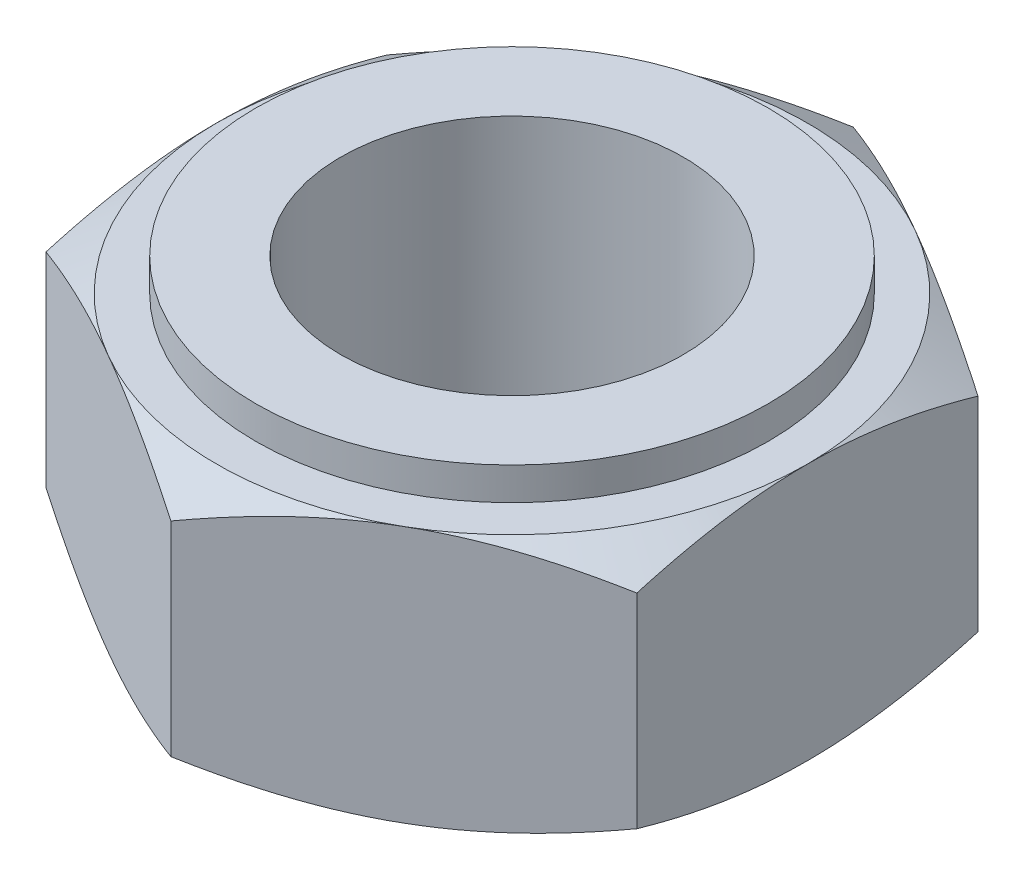
from build123d import *

# Parameters (mm, degrees)
SKETCH1_R               = 2
BOSS_EXTRUDE1_DEPTH     = 1.5
SKETCH6_R               = 2.991858429
SKETCH6_R_2             = 2
BOSS_EXTRUDE2_DEPTH     = 0.381
SKETCH5_OUTSIDE_W       = 35.584
SKETCH5_OUTSIDE_H       = 36.652
SKETCH5_OUTSIDE_R       = 3.45
CUT_EXTRUDE2_DEPTH      = 7.064033311
CUT_EXTRUDE2_DRAFT      = -60
MIRROR2_COPY_1_SKETCH_W = 35.584
MIRROR2_COPY_1_SKETCH_H = 36.652
MIRROR2_COPY_1_SKETCH_R = 3.45
MIRROR2_COPY_1_DEPTH    = 7.064033311
MIRROR2_COPY_1_DRAFT    = -60


with BuildPart() as part:
    # Sketch1 → Boss-Extrude1 (new, symmetric)
    with BuildSketch(Plane(origin=(0, 0, 0), x_dir=(1, 0, 0), z_dir=(0, 1, 0))):
        Polygon((-3.45, 1.991858429), (-3.45, -1.991858429), (0, -3.983716857), (3.45, -1.991858429), (3.45, 1.991858429), (0, 3.983716857), align=None)
        Circle(SKETCH1_R, mode=Mode.SUBTRACT)
    extrude(amount=BOSS_EXTRUDE1_DEPTH, both=True)

    # Sketch6 → Boss-Extrude2 (add)
    with BuildSketch(Plane(origin=(0, 1.5, 0), x_dir=(1, 0, 0), z_dir=(0, 1, 0))):
        Circle(SKETCH6_R)
        Circle(SKETCH6_R_2, mode=Mode.SUBTRACT)
    extrude(amount=BOSS_EXTRUDE2_DEPTH)


with BuildPart() as cut_extrude2_tool:
    # Sketch5 outside → Cut-Extrude2 (with draft: the straight prism first)
    with BuildSketch(Plane(origin=(0, 1.5, 0), x_dir=(1, 0, 0), z_dir=(0, 1, 0))):
        Rectangle(SKETCH5_OUTSIDE_W, SKETCH5_OUTSIDE_H)
        Circle(SKETCH5_OUTSIDE_R, mode=Mode.SUBTRACT)
    extrude(amount=-CUT_EXTRUDE2_DEPTH)
    # Cut-Extrude2: the draft: its side faces are tilted about the plane it starts from
    cut_extrude2_sides = [cut_extrude2_tool.faces().sort_by_distance(p)[0] for p in [
        (0, -2.032016656, 18.326),
        (17.792, -2.032016656, 0),
        (0, -2.032016656, -18.326),
        (-17.792, -2.032016656, 0),
        (-3.45, -2.032016656, 0),
    ]]
    draft(cut_extrude2_sides, Plane(origin=(0, 1.5, 0), x_dir=(1, 0, 0), z_dir=(0, 1, 0)), CUT_EXTRUDE2_DRAFT)


with BuildPart() as part_1:
    add(part.part)

    # Cut-Extrude2: cut by cut_extrude2_tool
    add(cut_extrude2_tool.part, mode=Mode.SUBTRACT)


with BuildPart() as mirror2_copy_1_tool:
    # Mirror2 copy 1 sketch → Mirror2 copy 1 (with draft: the straight prism first)
    with BuildSketch(Plane.XZ.offset(1.5)):
        Rectangle(MIRROR2_COPY_1_SKETCH_W, MIRROR2_COPY_1_SKETCH_H)
        Circle(MIRROR2_COPY_1_SKETCH_R, mode=Mode.SUBTRACT)
    extrude(amount=-MIRROR2_COPY_1_DEPTH)
    # Mirror2 copy 1: the draft: its side faces are tilted about the plane it starts from
    mirror2_copy_1_sides = [mirror2_copy_1_tool.faces().sort_by_distance(p)[0] for p in [
        (0, 2.032016656, 18.326),
        (17.792, 2.032016656, 0),
        (0, 2.032016656, -18.326),
        (-17.792, 2.032016656, 0),
        (-3.45, 2.032016656, 0),
    ]]
    draft(mirror2_copy_1_sides, Plane.XZ.offset(1.5), MIRROR2_COPY_1_DRAFT)


with BuildPart() as part_2:
    add(part_1.part)

    # Mirror2 copy 1: cut by mirror2_copy_1_tool
    add(mirror2_copy_1_tool.part, mode=Mode.SUBTRACT)


solid = part_2.part
